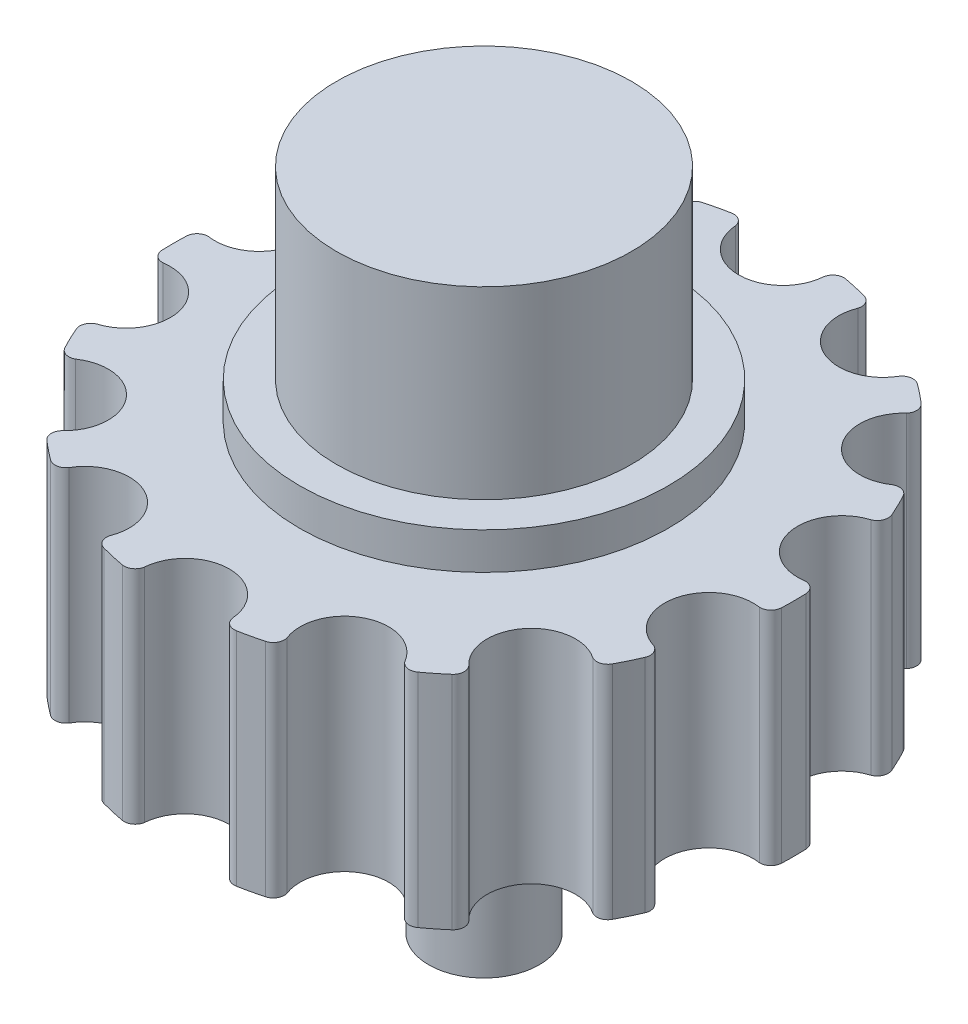
from build123d import *

# Parameters (mm, degrees)
BOSS_EXTRUDE1_DEPTH = 3
SKETCH2_R           = 0.75
BOSS_EXTRUDE2_DEPTH = 3
SKETCH3_R           = 2.5
BOSS_EXTRUDE3_DEPTH = 0.5
SKETCH4_R           = 2
BOSS_EXTRUDE4_DEPTH = 2.5


with BuildPart() as part:
    # Sketch1 → Boss-Extrude1 (new body)
    with BuildSketch(Plane(origin=(0, 0, 0), x_dir=(1, 0, 0), z_dir=(0, 1, 0))):
        with BuildLine():
            ThreePointArc((0.59835355, 4.007919609), (0.660413192, 4.106024801), (0.773897857, 4.130463677))
            ThreePointArc((0.773897857, 4.130463677), (0.935108267, 4.096977009), (1.094883149, 4.057200879))
            ThreePointArc((1.094883149, 4.057200879), (1.186525668, 3.985943061), (1.199873226, 3.870626668))
            ThreePointArc((1.199873226, 3.870626668), (1.497913497, 3.110449426), (2.278069066, 3.351394917))
            ThreePointArc((2.278069066, 3.351394917), (2.376549119, 3.412857971), (2.4893989, 3.385637488))
            ThreePointArc((2.4893989, 3.385637488), (2.62011514, 3.285520466), (2.746809119, 3.180359688))
            ThreePointArc((2.746809119, 3.180359688), (2.798458567, 3.076396414), (2.760450393, 2.966708646))
            ThreePointArc((2.760450393, 2.966708646), (2.699146854, 2.152497789), (3.506585066, 2.03108536))
            ThreePointArc((3.506585066, 2.03108536), (3.621980347, 2.043732765), (3.711843962, 1.970244271))
            ThreePointArc((3.711843962, 1.970244271), (3.786176077, 1.823326301), (3.854695856, 1.673609257))
            ThreePointArc((3.854695856, 1.673609257), (3.856122426, 1.557531728), (3.774286506, 1.475197592))
            ThreePointArc((3.774286506, 1.475197592), (3.365781075, 0.768217567), (4.040578887, 0.308494438))
            ThreePointArc((4.040578887, 0.308494438), (4.150033947, 0.269821219), (4.199112803, 0.164620014))
            ThreePointArc((4.199112803, 0.164620014), (4.202338407, 0), (4.199112803, -0.164620014))
            ThreePointArc((4.199112803, -0.164620014), (4.150033947, -0.269821219), (4.040578887, -0.308494438))
            ThreePointArc((4.040578887, -0.308494438), (3.365781075, -0.768217567), (3.774286506, -1.475197592))
            ThreePointArc((3.774286506, -1.475197592), (3.856122426, -1.557531728), (3.854695856, -1.673609257))
            ThreePointArc((3.854695856, -1.673609257), (3.786176077, -1.823326301), (3.711843962, -1.970244271))
            ThreePointArc((3.711843962, -1.970244271), (3.621980347, -2.043732765), (3.506585066, -2.03108536))
            ThreePointArc((3.506585066, -2.03108536), (2.699146854, -2.152497789), (2.760450393, -2.966708646))
            ThreePointArc((2.760450393, -2.966708646), (2.798458567, -3.076396414), (2.746809119, -3.180359688))
            ThreePointArc((2.746809119, -3.180359688), (2.62011514, -3.285520466), (2.4893989, -3.385637488))
            ThreePointArc((2.4893989, -3.385637488), (2.376549119, -3.412857971), (2.278069066, -3.351394917))
            ThreePointArc((2.278069066, -3.351394917), (1.497913497, -3.110449426), (1.199873226, -3.870626668))
            ThreePointArc((1.199873226, -3.870626668), (1.186525668, -3.985943061), (1.094883149, -4.057200879))
            ThreePointArc((1.094883149, -4.057200879), (0.935108267, -4.096977009), (0.773897857, -4.130463677))
            ThreePointArc((0.773897857, -4.130463677), (0.660413192, -4.106024801), (0.59835355, -4.007919609))
            ThreePointArc((0.59835355, -4.007919609), (0, -3.452338407), (-0.59835355, -4.007919609))
            ThreePointArc((-0.59835355, -4.007919609), (-0.660413192, -4.106024801), (-0.773897857, -4.130463677))
            ThreePointArc((-0.773897857, -4.130463677), (-0.935108267, -4.096977009), (-1.094883149, -4.057200879))
            ThreePointArc((-1.094883149, -4.057200879), (-1.186525668, -3.985943061), (-1.199873226, -3.870626668))
            ThreePointArc((-1.199873226, -3.870626668), (-1.497913497, -3.110449426), (-2.278069066, -3.351394917))
            ThreePointArc((-2.278069066, -3.351394917), (-2.376549119, -3.412857971), (-2.4893989, -3.385637488))
            ThreePointArc((-2.4893989, -3.385637488), (-2.62011514, -3.285520466), (-2.746809119, -3.180359688))
            ThreePointArc((-2.746809119, -3.180359688), (-2.798458567, -3.076396414), (-2.760450393, -2.966708646))
            ThreePointArc((-2.760450393, -2.966708646), (-2.699146854, -2.152497789), (-3.506585066, -2.03108536))
            ThreePointArc((-3.506585066, -2.03108536), (-3.621980347, -2.043732765), (-3.711843962, -1.970244271))
            ThreePointArc((-3.711843962, -1.970244271), (-3.786176077, -1.823326301), (-3.854695856, -1.673609257))
            ThreePointArc((-3.854695856, -1.673609257), (-3.856122426, -1.557531728), (-3.774286506, -1.475197592))
            ThreePointArc((-3.774286506, -1.475197592), (-3.365781075, -0.768217567), (-4.040578887, -0.308494438))
            ThreePointArc((-4.040578887, -0.308494438), (-4.150033947, -0.269821219), (-4.199112803, -0.164620014))
            ThreePointArc((-4.199112803, -0.164620014), (-4.202338407, 0), (-4.199112803, 0.164620014))
            ThreePointArc((-4.199112803, 0.164620014), (-4.150033947, 0.269821219), (-4.040578887, 0.308494438))
            ThreePointArc((-4.040578887, 0.308494438), (-3.365781075, 0.768217567), (-3.774286506, 1.475197592))
            ThreePointArc((-3.774286506, 1.475197592), (-3.856122426, 1.557531728), (-3.854695856, 1.673609257))
            ThreePointArc((-3.854695856, 1.673609257), (-3.786176077, 1.823326301), (-3.711843962, 1.970244271))
            ThreePointArc((-3.711843962, 1.970244271), (-3.621980347, 2.043732765), (-3.506585066, 2.03108536))
            ThreePointArc((-3.506585066, 2.03108536), (-2.699146854, 2.152497789), (-2.760450393, 2.966708646))
            ThreePointArc((-2.760450393, 2.966708646), (-2.798458567, 3.076396414), (-2.746809119, 3.180359688))
            ThreePointArc((-2.746809119, 3.180359688), (-2.62011514, 3.285520466), (-2.4893989, 3.385637488))
            ThreePointArc((-2.4893989, 3.385637488), (-2.376549119, 3.412857971), (-2.278069066, 3.351394917))
            ThreePointArc((-2.278069066, 3.351394917), (-1.497913497, 3.110449426), (-1.199873226, 3.870626668))
            ThreePointArc((-1.199873226, 3.870626668), (-1.186525668, 3.985943061), (-1.094883149, 4.057200879))
            ThreePointArc((-1.094883149, 4.057200879), (-0.935108267, 4.096977009), (-0.773897857, 4.130463677))
            ThreePointArc((-0.773897857, 4.130463677), (-0.660413192, 4.106024801), (-0.59835355, 4.007919609))
            ThreePointArc((-0.59835355, 4.007919609), (0, 3.452338407), (0.59835355, 4.007919609))
        make_face()
    extrude(amount=BOSS_EXTRUDE1_DEPTH)

    # Sketch2 → Boss-Extrude2 (add)
    with BuildSketch(Plane(origin=(0, 0, 0), x_dir=(-1, 0, 0), z_dir=(0, -1, 0))):
        with Locations(Location((0, 0, 0), (0, 0, 270))):
            Circle(SKETCH2_R)
    extrude(amount=BOSS_EXTRUDE2_DEPTH)

    # Sketch3 → Boss-Extrude3 (add)
    with BuildSketch(Plane(origin=(0, 3, 0), x_dir=(1, 0, 0), z_dir=(0, 1, 0))):
        with Locations(Location((0, 0, 0), (0, 0, 270))):
            Circle(SKETCH3_R)
    extrude(amount=BOSS_EXTRUDE3_DEPTH)

    # Sketch4 → Boss-Extrude4 (add)
    with BuildSketch(Plane(origin=(0, 3.5, 0), x_dir=(1, 0, 0), z_dir=(0, 1, 0))):
        with Locations(Location((0, 0, 0), (0, 0, 270))):
            Circle(SKETCH4_R)
    extrude(amount=BOSS_EXTRUDE4_DEPTH)


solid = part.part
